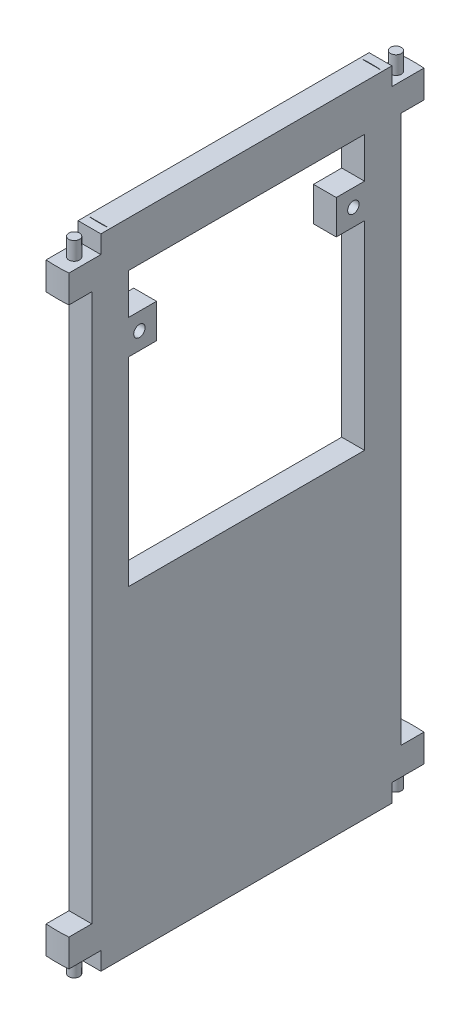
from build123d import *

# Parameters (mm, degrees)
SKETCH1_R               = 49.53
SKETCH1_R_2             = 38.1
BOSS_EXTRUDE1_DEPTH     = 12.7
SKETCH4_W               = 6.35
SKETCH4_H               = 10.16
BOSS_EXTRUDE4_DEPTH     = 152.4
SKETCH6_R               = 49.53
BOSS_EXTRUDE8_DEPTH     = 12.7
CUT_EXTRUDE1_DEPTH      = 192.10018786
CUT_EXTRUDE1_DEPTH_BACK = 192.10018786
SKETCH8_W               = 6.35
SKETCH8_H               = 9.525
BOSS_EXTRUDE9_DEPTH     = 7.874
SKETCH9_R               = 1.5875
CUT_EXTRUDE2_DEPTH      = 192.831674819
SKETCH10_W              = 182.98458546
SKETCH10_H              = 212.101714012
CUT_EXTRUDE3_DEPTH      = 192.831674819
SKETCH13_W              = 128.016671202
SKETCH13_H              = 210.018995068
CUT_EXTRUDE4_DEPTH      = 191.199216379
SKETCH14_W              = 6.35
SKETCH14_H              = 8.918129625
SKETCH14_R              = 1.5
CUT_EXTRUDE5_DEPTH      = 5
SKETCH15_W              = 8.919843596
SKETCH15_H              = 5.203541281
CUT_EXTRUDE6_DEPTH      = 5
MIRROR4_COPY_1_SKETCH_W = 6.35
MIRROR4_COPY_1_SKETCH_H = 8.918129625
MIRROR4_COPY_1_SKETCH_R = 1.5
MIRROR4_COPY_1_DEPTH    = 5
MIRROR4_COPY_2_SKETCH_W = 8.919843596
MIRROR4_COPY_2_SKETCH_H = 5.203541281
MIRROR4_COPY_2_DEPTH    = 5
SKETCH16_W              = 6.35
SKETCH16_H              = 65.7800056
BOSS_EXTRUDE10_DEPTH    = 76.2


with BuildPart() as part:
    # Sketch1 → Boss-Extrude1 (new body)
    # profile 1 of 2: a face of its own
    with BuildSketch(Plane(origin=(0, 0, 0), x_dir=(1, 0, 0), z_dir=(0, 1, 0))):
        with Locations(Location((0, 0, 0), (0, 0, 270))):
            Circle(SKETCH1_R)
        Circle(SKETCH1_R_2, mode=Mode.SUBTRACT)
    # profile 2 of 2: a face of its own
    with BuildSketch(Plane(origin=(0, 0, 0), x_dir=(1, 0, 0), z_dir=(0, 1, 0))):
        with BuildLine():
            Line((-3.175, 37.967477859), (-3.175, -37.967477859))
            ThreePointArc((-3.175, -37.967477859), (0, -38.1), (3.175, -37.967477859))
            Line((3.175, -37.967477859), (3.175, 37.967477859))
            ThreePointArc((3.175, 37.967477859), (0, 38.1), (-3.175, 37.967477859))
        make_face()
    extrude(amount=BOSS_EXTRUDE1_DEPTH)

    # Sketch4 → Boss-Extrude4 (add)
    with BuildSketch(Plane(origin=(0, 12.7, 0), x_dir=(1, 0, 0), z_dir=(0, 1, 0))):
        with Locations((0, -37.9700028)):
            Rectangle(SKETCH4_W, SKETCH4_H)
        with Locations((0, 37.9700028)):
            Rectangle(SKETCH4_W, SKETCH4_H)
    extrude(amount=BOSS_EXTRUDE4_DEPTH)

    # Sketch6 → Boss-Extrude8 (add)
    with BuildSketch(Plane(origin=(0, 165.1, 0), x_dir=(1, 0, 0), z_dir=(0, 1, 0))):
        with Locations(Location((0, 0, 0), (0, 0, 270))):
            Circle(SKETCH6_R)
        with BuildLine():
            Line((-3.144660136, -37.9700028), (3.144660136, -37.9700028))
            ThreePointArc((3.144660136, -37.9700028), (0, -38.1), (-3.144660136, -37.9700028))
        make_face(mode=Mode.SUBTRACT)
        with BuildLine():
            Line((3.175, -37.967477859), (3.175, 37.967477859))
            ThreePointArc((3.175, 37.967477859), (38.1, 0), (3.175, -37.967477859))
        make_face(mode=Mode.SUBTRACT)
        with BuildLine():
            Line((3.144660136, 37.9700028), (-3.144660136, 37.9700028))
            ThreePointArc((-3.144660136, 37.9700028), (0, 38.1), (3.144660136, 37.9700028))
        make_face(mode=Mode.SUBTRACT)
        with BuildLine():
            Line((-3.175, 37.967477859), (-3.175, -37.967477859))
            ThreePointArc((-3.175, -37.967477859), (-38.1, 0), (-3.175, 37.967477859))
        make_face(mode=Mode.SUBTRACT)
    extrude(amount=BOSS_EXTRUDE8_DEPTH)

    # Sketch7 → Cut-Extrude1 (cut, two sides: drawn at the far end of the back side and taken through both)
    with BuildSketch(Plane.XZ.offset(-CUT_EXTRUDE1_DEPTH_BACK)):
        with BuildLine():
            Line((-49.106263984, -6.464962301), (-40.292319166, -5.304584452))
            ThreePointArc((-40.292319166, -5.304584452), (-40.64, 0), (-40.292319166, 5.304584452))
            Line((-40.292319166, 5.304584452), (-49.106263984, 6.464962301))
            ThreePointArc((-49.106263984, 6.464962301), (-49.53, 0), (-49.106263984, -6.464962301))
        make_face()
        with BuildLine():
            Line((40.292319166, -5.304584452), (49.106263984, -6.464962301))
            ThreePointArc((49.106263984, -6.464962301), (49.423952468, -3.239416991), (49.53, 0))
            ThreePointArc((49.53, 0), (49.423952468, 3.239416991), (49.106263984, 6.464962301))
            Line((49.106263984, 6.464962301), (40.292319166, 5.304584452))
            ThreePointArc((40.292319166, 5.304584452), (40.64, 0), (40.292319166, -5.304584452))
        make_face()
        with BuildLine():
            Line((37.774049218, -4.973047924), (40.292319166, -5.304584452))
            ThreePointArc((40.292319166, -5.304584452), (40.64, 0), (40.292319166, 5.304584452))
            Line((40.292319166, 5.304584452), (37.774049218, 4.973047924))
            ThreePointArc((37.774049218, 4.973047924), (38.1, 0), (37.774049218, -4.973047924))
        make_face()
        with BuildLine():
            Line((-40.292319166, -5.304584452), (-37.774049218, -4.973047924))
            ThreePointArc((-37.774049218, -4.973047924), (-38.1, 0), (-37.774049218, 4.973047924))
            Line((-37.774049218, 4.973047924), (-40.292319166, 5.304584452))
            ThreePointArc((-40.292319166, 5.304584452), (-40.64, 0), (-40.292319166, -5.304584452))
        make_face()
    extrude(amount=CUT_EXTRUDE1_DEPTH + CUT_EXTRUDE1_DEPTH_BACK, mode=Mode.SUBTRACT)

    # Sketch8 → Boss-Extrude9 (add)
    with BuildSketch(Plane.XY.offset(-32.8900028)):
        with Locations((0, 28.7655)):
            Rectangle(SKETCH8_W, SKETCH8_H)
        with Locations((0, 149.0345)):
            Rectangle(SKETCH8_W, SKETCH8_H)
    boss_extrude9 = extrude(amount=BOSS_EXTRUDE9_DEPTH)

    # Mirror1: Boss-Extrude9 across plane
    add(boss_extrude9.mirror(Plane.XY.offset(0.0029972)))

    # Sketch9 → Cut-Extrude2 (cut, through all)
    with BuildSketch(Plane(origin=(3.175, 0, 0), x_dir=(0, 0, -1), z_dir=(1, 0, 0))):
        with Locations((29.7785028, 28.7655)):
            Circle(SKETCH9_R)
        with Locations((29.7785028, 149.0345)):
            Circle(SKETCH9_R)
    cut_extrude2 = extrude(amount=-CUT_EXTRUDE2_DEPTH, mode=Mode.SUBTRACT)

    # Mirror2: Cut-Extrude2 across plane
    add(cut_extrude2.mirror(Plane.XY.offset(0.0029972)), mode=Mode.SUBTRACT)

    # Sketch10 → Cut-Extrude3 (cut, through all)
    with BuildSketch(Plane.ZY.offset(3.175)):
        with Locations((0.893156514, 95.768616586)):
            Rectangle(SKETCH10_W, SKETCH10_H)
    extrude(amount=CUT_EXTRUDE3_DEPTH, mode=Mode.SUBTRACT)

    # Sketch13 → Cut-Extrude4 (cut, through all)
    with BuildSketch(Plane(origin=(3.175, 0, 0), x_dir=(0, 0, -1), z_dir=(1, 0, 0))):
        with Locations((3.230681638, 97.01833452)):
            Rectangle(SKETCH13_W, SKETCH13_H)
    extrude(amount=CUT_EXTRUDE4_DEPTH, mode=Mode.SUBTRACT)

    # Sketch14 → Cut-Extrude5 (cut)
    with BuildSketch(Plane(origin=(0, 177.8, 0), x_dir=(1, 0, 0), z_dir=(0, 1, 0))):
        with Locations((0, 44.969067612)):
            Rectangle(SKETCH14_W, SKETCH14_H)
        with Locations(Location((0.015169932, 44.788132425, 0), (0, 0, 270))):
            Circle(SKETCH14_R, mode=Mode.SUBTRACT)
    cut_extrude5 = extrude(amount=-CUT_EXTRUDE5_DEPTH, mode=Mode.SUBTRACT)

    # Sketch15 → Cut-Extrude6 (cut)
    with BuildSketch(Plane(origin=(0, 172.8, 0), x_dir=(1, 0, 0), z_dir=(0, 1, 0))):
        with Locations((0.161262395, 49.49484543)):
            Rectangle(SKETCH15_W, SKETCH15_H)
    cut_extrude6 = extrude(amount=CUT_EXTRUDE6_DEPTH, mode=Mode.SUBTRACT)

    # Mirror3: Cut-Extrude5, Cut-Extrude6 across plane
    add(cut_extrude5.mirror(Plane.XY.offset(0.0029972)), mode=Mode.SUBTRACT)
    add(cut_extrude6.mirror(Plane.XY.offset(0.0029972)), mode=Mode.SUBTRACT)

    # Mirror4: Cut-Extrude5, Cut-Extrude6 across plane
    add(cut_extrude5.mirror(Plane(origin=(0, 88.9, 0), x_dir=(0, 0, 1), z_dir=(0, -1, 0))), mode=Mode.SUBTRACT)
    add(cut_extrude6.mirror(Plane(origin=(0, 88.9, 0), x_dir=(0, 0, 1), z_dir=(0, -1, 0))), mode=Mode.SUBTRACT)

    # Mirror4 copy 1 sketch → Mirror4 copy 1 (cut)
    with BuildSketch(Plane(origin=(0, 0, 0.0059944), x_dir=(1, 0, 0), z_dir=(0, -1, 0))):
        with Locations((0, 44.969067612)):
            Rectangle(MIRROR4_COPY_1_SKETCH_W, MIRROR4_COPY_1_SKETCH_H)
        with Locations(Location((0.015169932, 44.788132425, 0), (0, 0, 270))):
            Circle(MIRROR4_COPY_1_SKETCH_R, mode=Mode.SUBTRACT)
    extrude(amount=-MIRROR4_COPY_1_DEPTH, mode=Mode.SUBTRACT)

    # Mirror4 copy 2 sketch → Mirror4 copy 2 (cut)
    with BuildSketch(Plane(origin=(0, 5, 0.0059944), x_dir=(1, 0, 0), z_dir=(0, -1, 0))):
        with Locations((0.161262395, 49.49484543)):
            Rectangle(MIRROR4_COPY_2_SKETCH_W, MIRROR4_COPY_2_SKETCH_H)
    extrude(amount=MIRROR4_COPY_2_DEPTH, mode=Mode.SUBTRACT)

    # Sketch16 → Boss-Extrude10 (add)
    with BuildSketch(Plane(origin=(0, 12.7, 0), x_dir=(1, 0, 0), z_dir=(0, 1, 0))):
        Rectangle(SKETCH16_W, SKETCH16_H)
    extrude(amount=BOSS_EXTRUDE10_DEPTH)


solid = part.part
